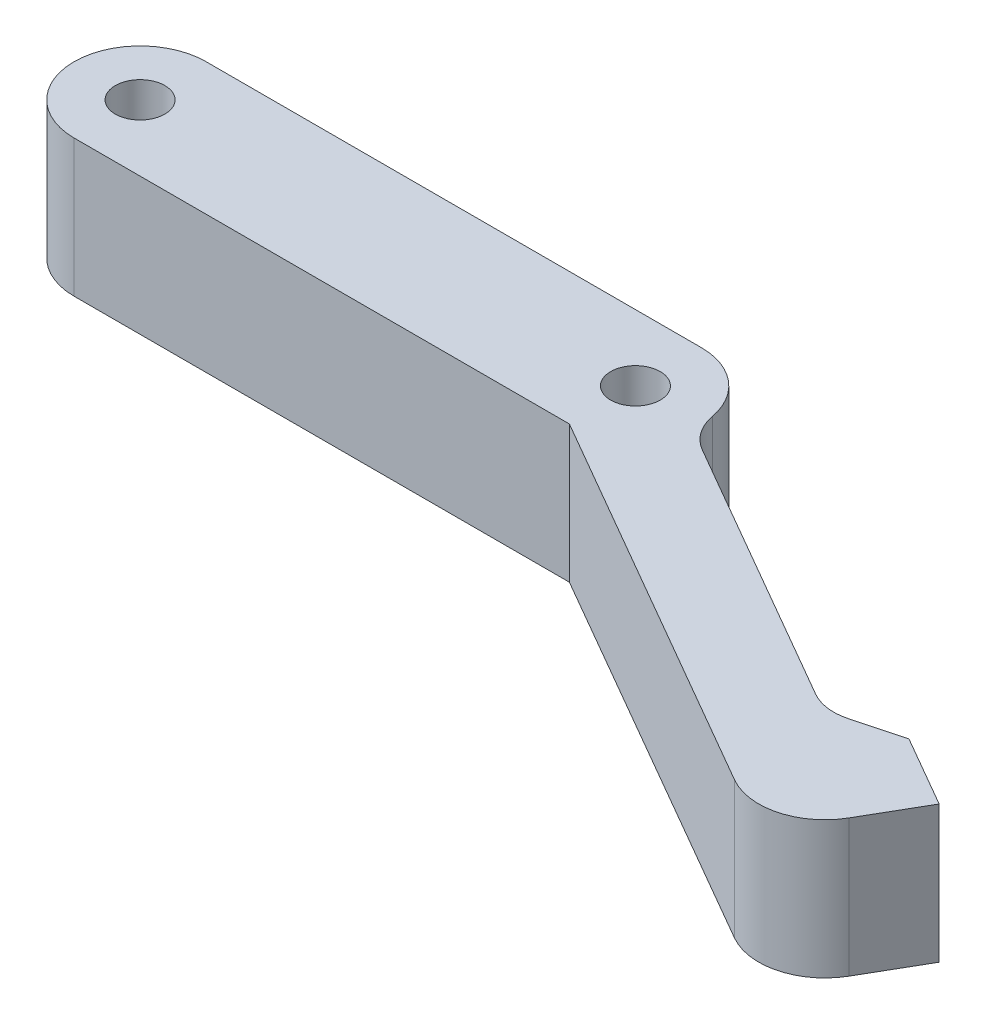
from build123d import *

# Parameters (mm, degrees)
SKETCH1_R           = 1.5
BOSS_EXTRUDE1_DEPTH = 8.3
FILLET1_R           = 3


with BuildPart() as part:
    # Sketch1 → Boss-Extrude1 (new body)
    with BuildSketch(Plane(origin=(0, 0, 0), x_dir=(1, 0, 0), z_dir=(0, 1, 0))):
        with BuildLine():
            Line((0, 4), (30, 4))
            ThreePointArc((30, 4), (33.005515029, 2.639484686), (33.966505447, -0.516560296))
            Line((33.966505447, -0.516560296), (52.699163274, -11.331865335))
            Line((52.699163274, -11.331865335), (56.797239485, -10.233789123))
            Line((56.797239485, -10.233789123), (61.127366504, -12.733789123))
            Line((61.127366504, -12.733789123), (59.127366504, -16.197890739))
            ThreePointArc((59.127366504, -16.197890739), (56.69854107, -18.061594044), (53.663264889, -17.661992354))
            Line((53.663264889, -17.661992354), (30, -4))
            Line((30, -4), (0, -4))
            ThreePointArc((0, -4), (-4, 0), (0, 4))
        make_face()
        with Locations(Location((0, 0, 0), (0, 0, 90))):
            Circle(SKETCH1_R, mode=Mode.SUBTRACT)
        with Locations(Location((30, 0, 0), (0, 0, 90))):
            Circle(SKETCH1_R, mode=Mode.SUBTRACT)
    extrude(amount=BOSS_EXTRUDE1_DEPTH)

    # Fillet1
    fillet1_edges = [part.edges().sort_by_distance(p)[0] for p in [
        (52.699163274, 4.15, 11.331865335),
        (33.966505447, 4.15, 0.516560296),
    ]]
    fillet(fillet1_edges, radius=FILLET1_R)


solid = part.part
